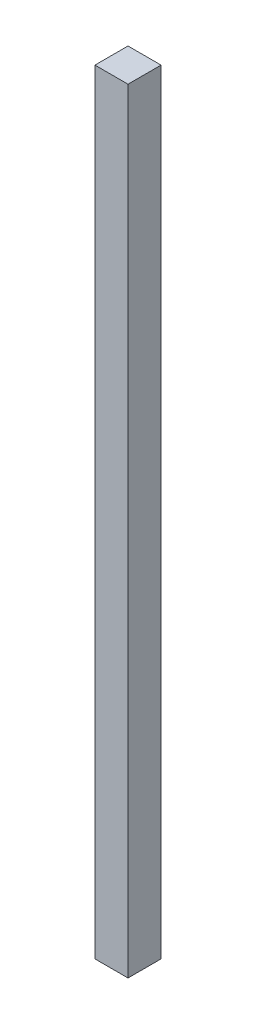
from build123d import *

# Parameters (mm, degrees)
SKETCH1_W           = 25.4
SKETCH1_H           = 25.4
BOSS_EXTRUDE1_DEPTH = 609.6
SKETCH5_W           = 25.4
SKETCH5_H           = 15.071045032
CUT_EXTRUDE3_DEPTH  = 25.4


with BuildPart() as part:
    # Sketch1 → Boss-Extrude1 (new body)
    with BuildSketch(Plane(origin=(0, 0, 0), x_dir=(1, 0, 0), z_dir=(0, 1, 0))):
        with Locations((12.7, 12.7)):
            Rectangle(SKETCH1_W, SKETCH1_H)
    extrude(amount=BOSS_EXTRUDE1_DEPTH)

    # Sketch5 → Cut-Extrude3 (cut)
    with BuildSketch(Plane(origin=(0, 0, -25.4), x_dir=(-1, 0, 0), z_dir=(0, 0, -1))):
        with Locations((-12.7, 602.064477484)):
            Rectangle(SKETCH5_W, SKETCH5_H)
    extrude(amount=-CUT_EXTRUDE3_DEPTH, mode=Mode.SUBTRACT)


solid = part.part
